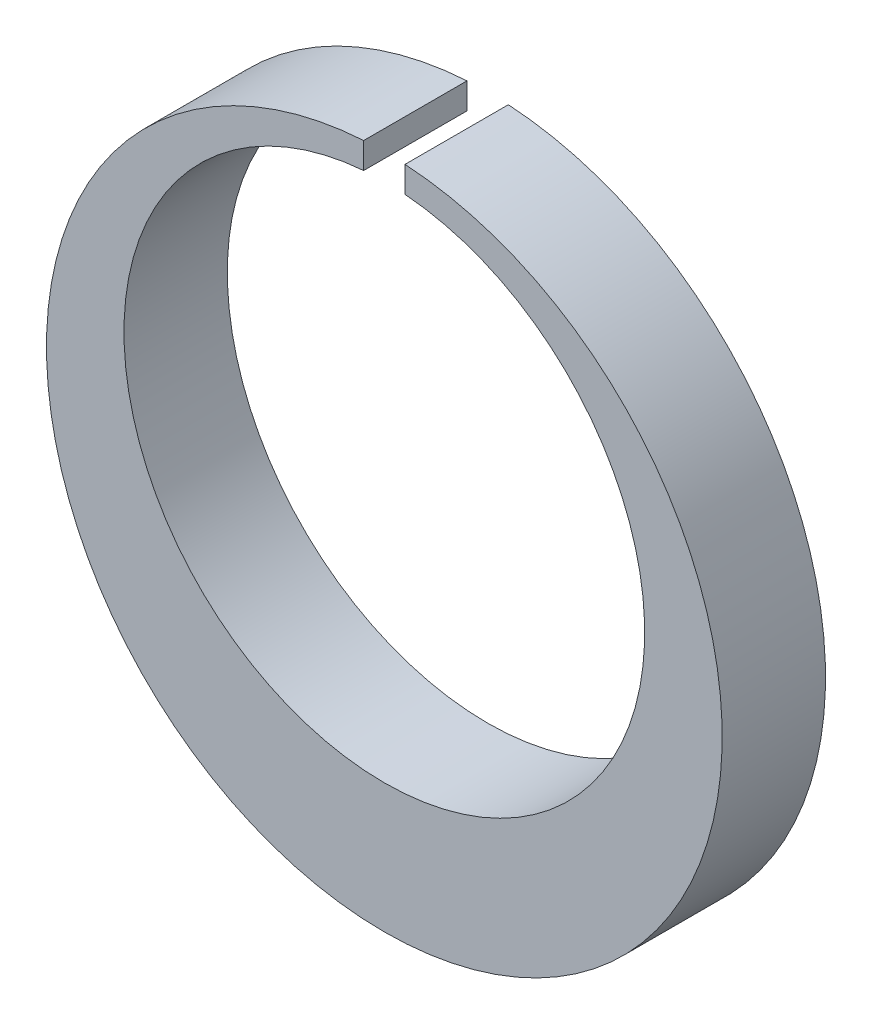
from build123d import *

# Parameters (mm, degrees)
BOSS_EXTRUDE1_DEPTH = 12.7


with BuildPart() as part:
    # Sketch1 → Boss-Extrude1 (new body)
    with BuildSketch(Plane.XY):
        with BuildLine():
            Line((-2.54, 41.45125138), (-2.54, 38.253047127))
            ThreePointArc((-2.54, 38.253047127), (0, -25.654), (2.54, 38.253047127))
            Line((2.54, 38.253047127), (2.54, 41.45125138))
            ThreePointArc((2.54, 41.45125138), (0, -41.529), (-2.54, 41.45125138))
        make_face()
    extrude(amount=BOSS_EXTRUDE1_DEPTH)


solid = part.part
